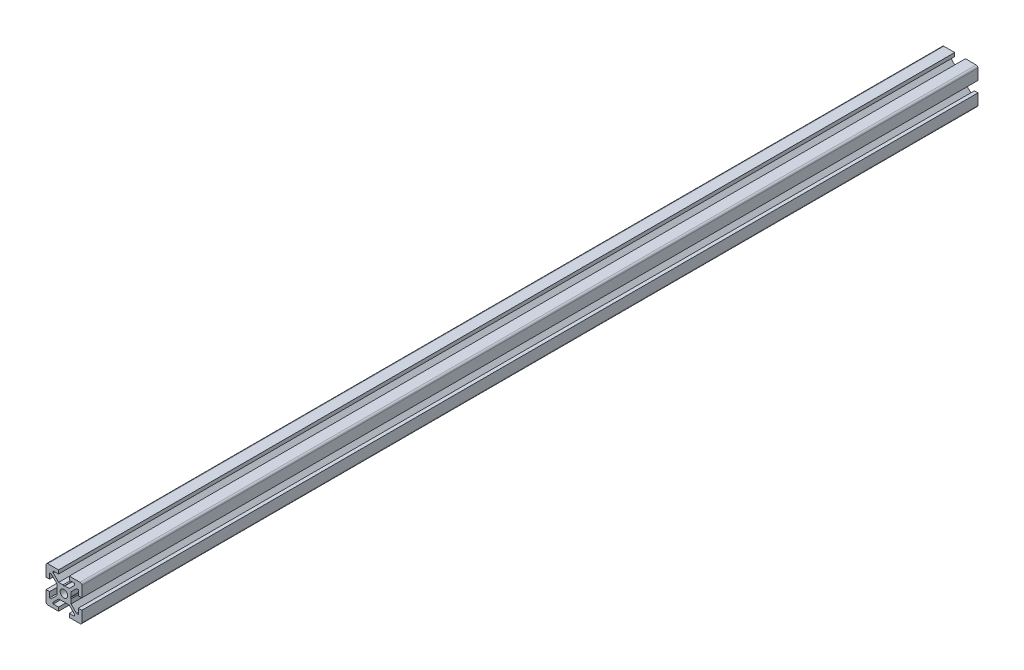
from build123d import *

# Parameters (mm, degrees)
SKETCH1_R           = 2.1
BOSS_EXTRUDE1_DEPTH = 500


with BuildPart() as part:
    # Sketch1 → Boss-Extrude1 (new body)
    with BuildSketch(Plane(origin=(0, 0, -500), x_dir=(-1, 0, 0), z_dir=(0, 0, -1))):
        with BuildLine():
            Line((9, 10), (3, 10))
            Line((3, 10), (3, 8))
            Line((3, 8), (6, 8))
            Line((6, 8), (6, 7.060660172))
            Line((6, 7.060660172), (2.939339828, 4))
            Line((2.939339828, 4), (0.519615242, 4))
            Line((0.519615242, 4), (0, 3.7))
            Line((0, 3.7), (-0.519615242, 4))
            Line((-0.519615242, 4), (-2.939339828, 4))
            Line((-2.939339828, 4), (-6, 7.060660172))
            Line((-6, 7.060660172), (-6, 8))
            Line((-6, 8), (-3, 8))
            Line((-3, 8), (-3, 10))
            Line((-3, 10), (-9, 10))
            ThreePointArc((-9, 10), (-9.707106781, 9.707106781), (-10, 9))
            Line((-10, 9), (-10, 3))
            Line((-10, 3), (-8, 3))
            Line((-8, 3), (-8, 6))
            Line((-8, 6), (-7.060660172, 6))
            Line((-7.060660172, 6), (-4, 2.939339828))
            Line((-4, 2.939339828), (-4, 0.519615242))
            Line((-4, 0.519615242), (-3.7, 0))
            Line((-3.7, 0), (-4, -0.519615242))
            Line((-4, -0.519615242), (-4, -2.939339828))
            Line((-4, -2.939339828), (-7.060660172, -6))
            Line((-7.060660172, -6), (-8, -6))
            Line((-8, -6), (-8, -3))
            Line((-8, -3), (-10, -3))
            Line((-10, -3), (-10, -9))
            ThreePointArc((-10, -9), (-9.707106781, -9.707106781), (-9, -10))
            Line((-9, -10), (-3, -10))
            Line((-3, -10), (-3, -8))
            Line((-3, -8), (-6, -8))
            Line((-6, -8), (-6, -7.060660172))
            Line((-6, -7.060660172), (-2.939339828, -4))
            Line((-2.939339828, -4), (-0.519615242, -4))
            Line((-0.519615242, -4), (0, -3.7))
            Line((0, -3.7), (0.519615242, -4))
            Line((0.519615242, -4), (2.939339828, -4))
            Line((2.939339828, -4), (6, -7.060660172))
            Line((6, -7.060660172), (6, -8))
            Line((6, -8), (3, -8))
            Line((3, -8), (3, -10))
            Line((3, -10), (9, -10))
            ThreePointArc((9, -10), (9.707106781, -9.707106781), (10, -9))
            Line((10, -9), (10, -3))
            Line((10, -3), (8, -3))
            Line((8, -3), (8, -6))
            Line((8, -6), (7.060660172, -6))
            Line((7.060660172, -6), (4, -2.939339828))
            Line((4, -2.939339828), (4, -0.519615242))
            Line((4, -0.519615242), (3.7, 0))
            Line((3.7, 0), (4, 0.519615242))
            Line((4, 0.519615242), (4, 2.939339828))
            Line((4, 2.939339828), (7.060660172, 6))
            Line((7.060660172, 6), (8, 6))
            Line((8, 6), (8, 3))
            Line((8, 3), (10, 3))
            Line((10, 3), (10, 9))
            ThreePointArc((10, 9), (9.707106781, 9.707106781), (9, 10))
        make_face()
        with Locations(Location((0, 0, 0), (0, 0, 180))):
            Circle(SKETCH1_R, mode=Mode.SUBTRACT)
    extrude(amount=-BOSS_EXTRUDE1_DEPTH)


solid = part.part
